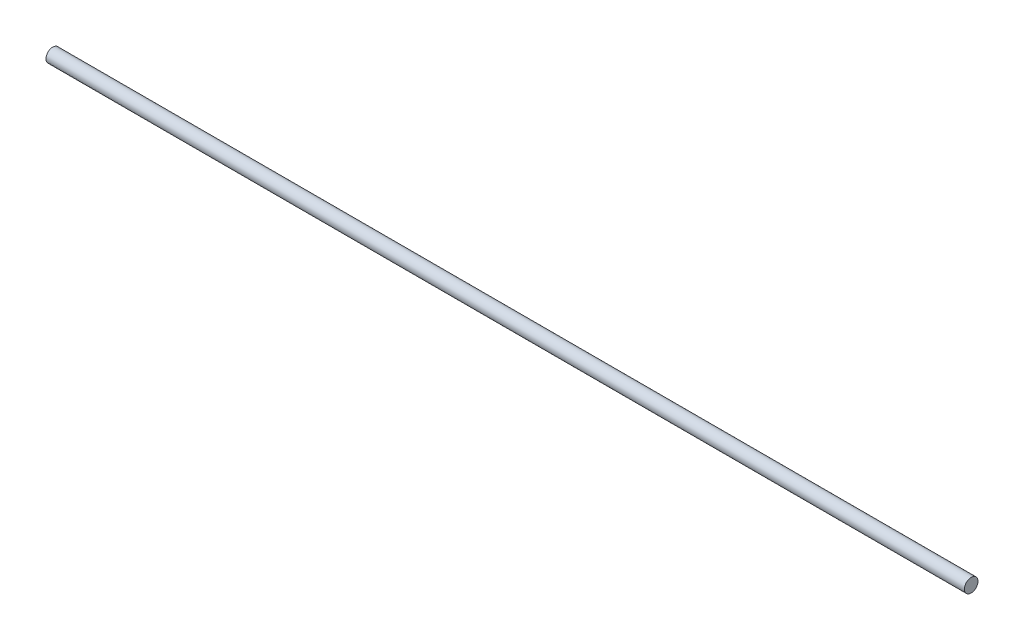
from build123d import *

# Parameters (mm, degrees)
SKETCH1_R           = 5
BOSS_EXTRUDE1_DEPTH = 338


with BuildPart() as part:
    # Sketch1 → Boss-Extrude1 (new, symmetric)
    with BuildSketch(Plane(origin=(0, 0, 0), x_dir=(0, 0, -1), z_dir=(1, 0, 0))):
        Circle(SKETCH1_R)
    extrude(amount=BOSS_EXTRUDE1_DEPTH, both=True)


solid = part.part
